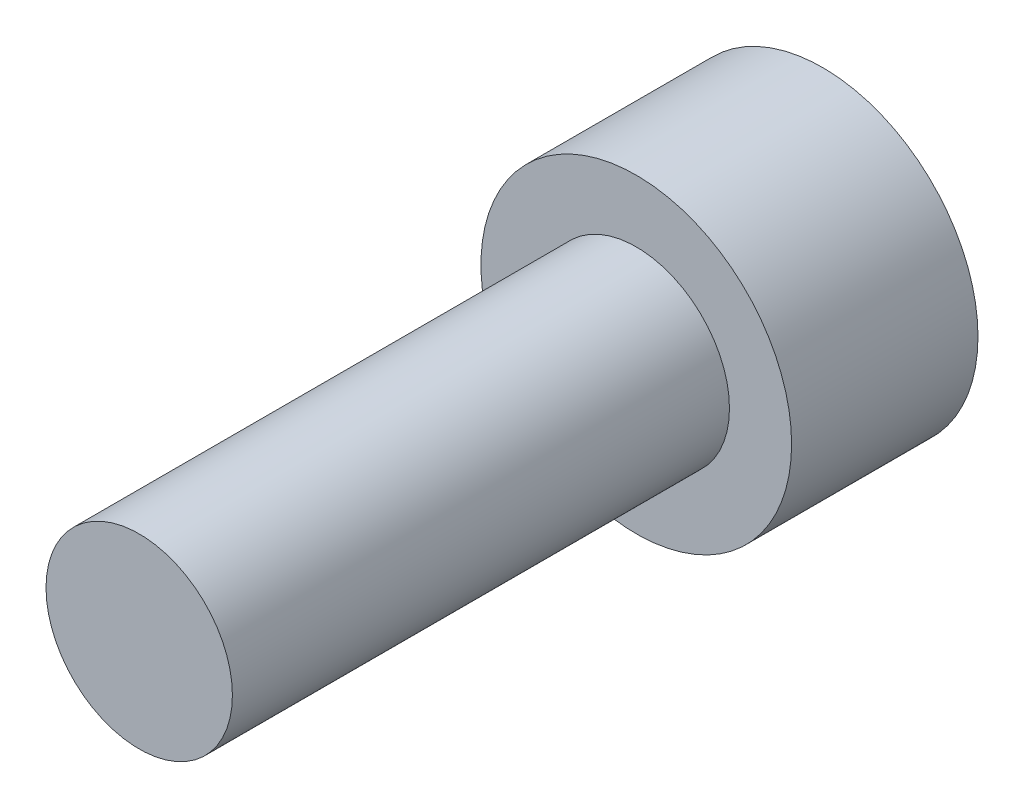
from build123d import *

# Parameters (mm, degrees)
SKETCH1_R           = 3
BOSS_EXTRUDE1_DEPTH = 16
SKETCH2_R           = 5
BOSS_EXTRUDE2_DEPTH = 6


with BuildPart() as part:
    # Sketch1 → Boss-Extrude1 (new body)
    with BuildSketch(Plane.XY):
        Circle(SKETCH1_R)
    extrude(amount=BOSS_EXTRUDE1_DEPTH)

    # Sketch2 → Boss-Extrude2 (add)
    with BuildSketch(Plane.XY):
        Circle(SKETCH2_R)
    extrude(amount=-BOSS_EXTRUDE2_DEPTH)


solid = part.part
